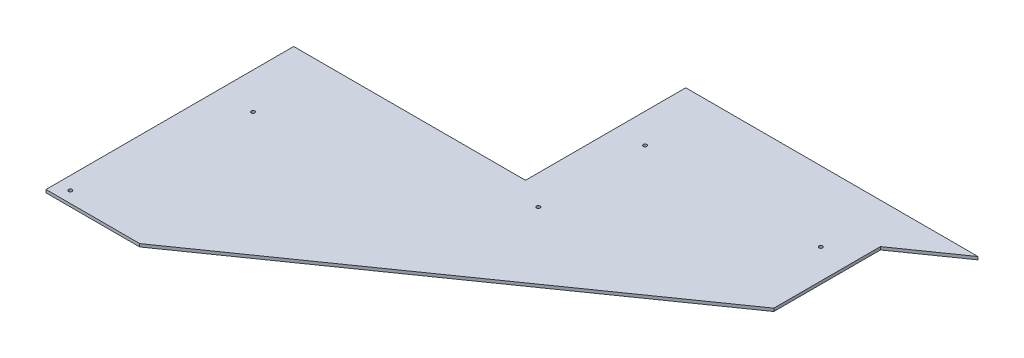
from build123d import *

# Parameters (mm, degrees)
SKETCH1_R           = 3.3782
BOSS_EXTRUDE1_DEPTH = 5.588


with BuildPart() as part:
    # Sketch1 (on Top Plane) → Boss-Extrude1 (new body)
    with BuildSketch(Plane(origin=(0, 0, 0), x_dir=(1, 0, 0), z_dir=(0, 1, 0))):
        Polygon((0, 0), (0, 469.9), (439.7375, 469.9), (439.7375, 773.938), (994.205378114, 773.938), (885.3805, 697.738), (885.3805, 495.45319999), (177.8, 0), align=None)
        with Locations(Location((24.6253, 21.463, 0), (0, 0, 270))):
            Circle(SKETCH1_R, mode=Mode.SUBTRACT)
        with Locations(Location((69.0753, 323.85, 0), (0, 0, 270))):
            Circle(SKETCH1_R, mode=Mode.SUBTRACT)
        with Locations(Location((495.8715, 438.15, 0), (0, 0, 270))):
            Circle(SKETCH1_R, mode=Mode.SUBTRACT)
        with Locations(Location((495.8715, 640.588, 0), (0, 0, 270))):
            Circle(SKETCH1_R, mode=Mode.SUBTRACT)
        with Locations(Location((829.2465, 640.588, 0), (0, 0, 270))):
            Circle(SKETCH1_R, mode=Mode.SUBTRACT)
    extrude(amount=BOSS_EXTRUDE1_DEPTH)


solid = part.part
